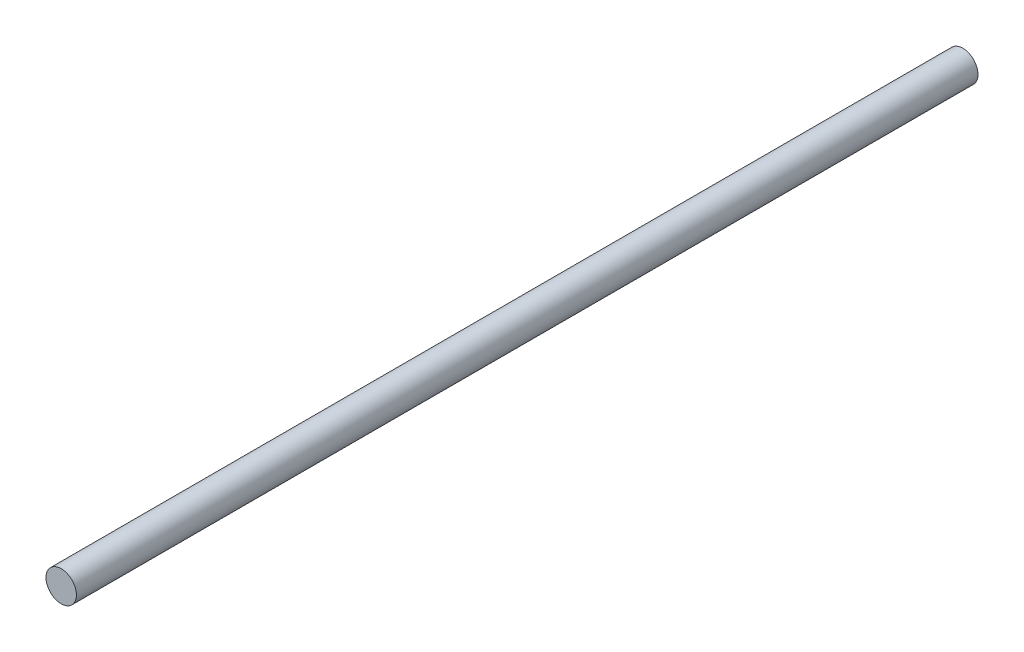
from build123d import *

# Parameters (mm, degrees)
ESQUISSE1_R        = 4
BOSS_EXTRU_1_DEPTH = 237


with BuildPart() as part:
    # Esquisse1 → Boss.-Extru.1 (new body)
    with BuildSketch(Plane.XY):
        Circle(ESQUISSE1_R)
    extrude(amount=BOSS_EXTRU_1_DEPTH)


solid = part.part
